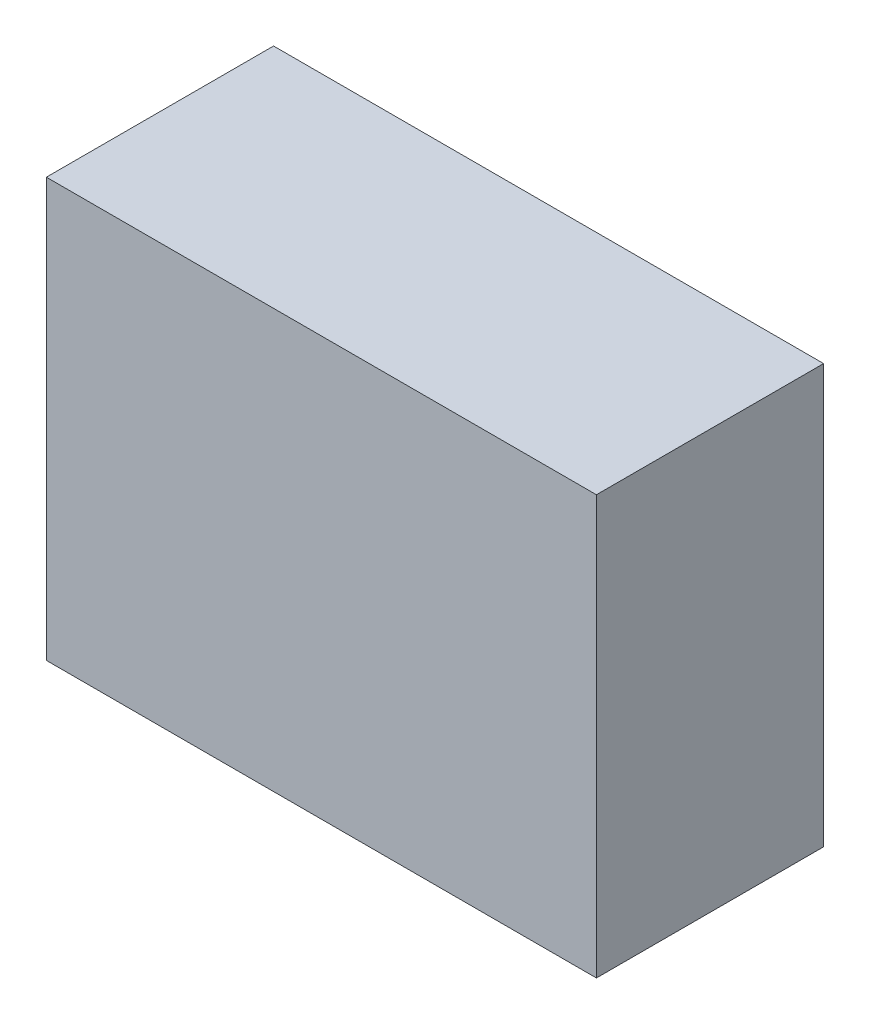
from build123d import *

# Parameters (mm, degrees)
SKETCH1_W           = 4.6
SKETCH1_H           = 3.5
BOSS_EXTRUDE1_DEPTH = 1.9


with BuildPart() as part:
    # Sketch1 → Boss-Extrude1 (new body)
    with BuildSketch(Plane.XY):
        with Locations((2.3, 1.75)):
            Rectangle(SKETCH1_W, SKETCH1_H)
    extrude(amount=BOSS_EXTRUDE1_DEPTH)


solid = part.part
